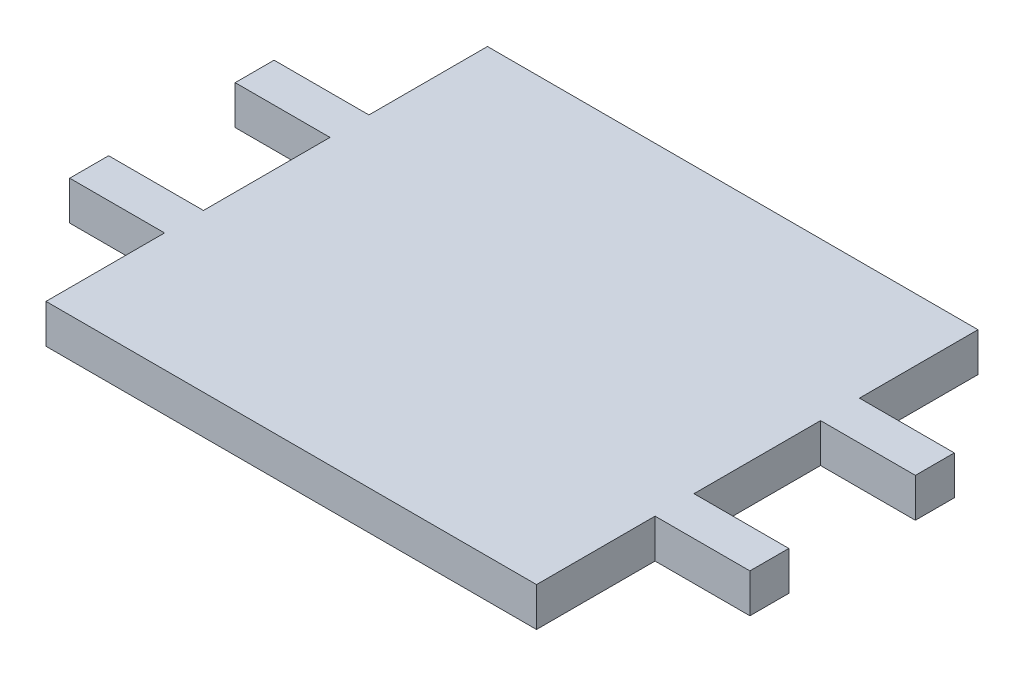
from build123d import *

# Parameters (mm, degrees)
SKETCH1_W           = 76.2
SKETCH1_H           = 68.58
SKETCH1_W_2         = 14.732
SKETCH1_H_2         = 6.0452
BOSS_EXTRUDE1_DEPTH = 6.0452


with BuildPart() as part:
    # Sketch1 → Boss-Extrude1 (new body)
    with BuildSketch(Plane(origin=(0, 0, 0), x_dir=(1, 0, 0), z_dir=(0, 1, 0))):
        Rectangle(SKETCH1_W, SKETCH1_H)
        with Locations((-45.466, -12.8524)):
            Rectangle(SKETCH1_W_2, SKETCH1_H_2)
        with Locations((-45.466, 12.8524)):
            Rectangle(SKETCH1_W_2, SKETCH1_H_2)
        with Locations((45.466, 12.8524)):
            Rectangle(SKETCH1_W_2, SKETCH1_H_2)
        with Locations((45.466, -12.8524)):
            Rectangle(SKETCH1_W_2, SKETCH1_H_2)
    extrude(amount=BOSS_EXTRUDE1_DEPTH)


solid = part.part
